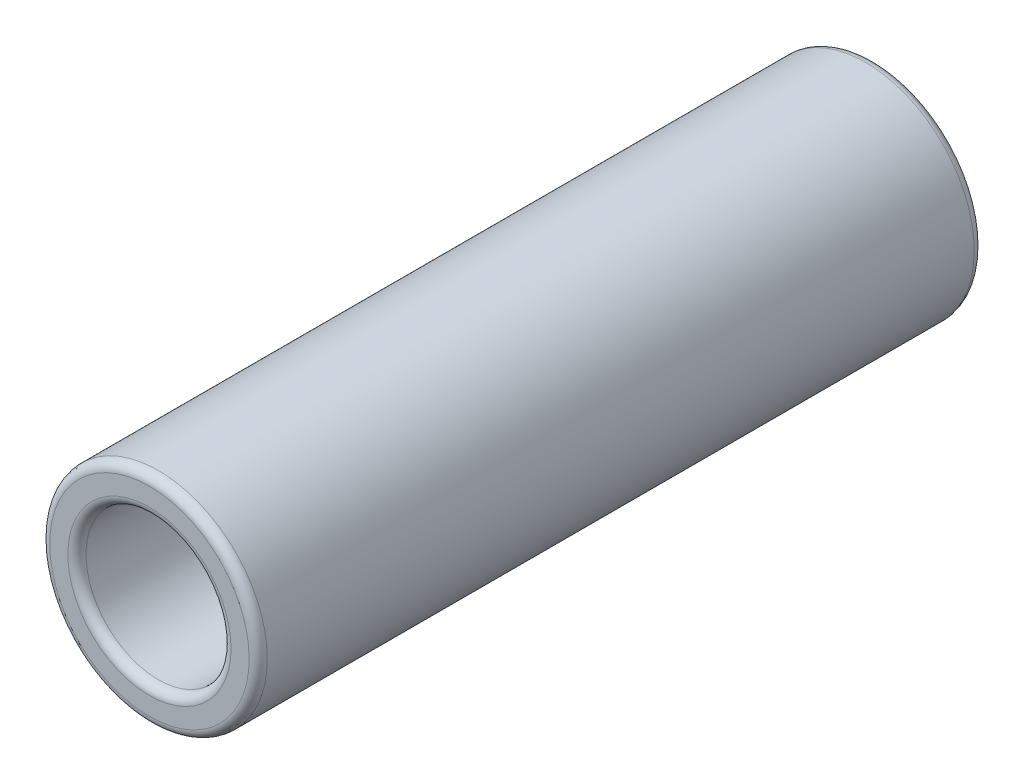
from build123d import *

# Parameters (mm, degrees)
SKETCH1_R           = 6
SKETCH1_R_2         = 4
BOSS_EXTRUDE1_DEPTH = 20
FILLET1_R           = 0.5


with BuildPart() as part:
    # Sketch1 → Boss-Extrude1 (new, symmetric)
    with BuildSketch(Plane.XY):
        Circle(SKETCH1_R)
        Circle(SKETCH1_R_2, mode=Mode.SUBTRACT)
    extrude(amount=BOSS_EXTRUDE1_DEPTH, both=True)

    # Fillet1
    fillet1_edges = [part.edges().sort_by_distance(p)[0] for p in [
        (-6, 0, -20),
        (-6, 0, 20),
        (-4, 0, -20),
        (-4, 0, 20),
    ]]
    fillet(fillet1_edges, radius=FILLET1_R)


solid = part.part
